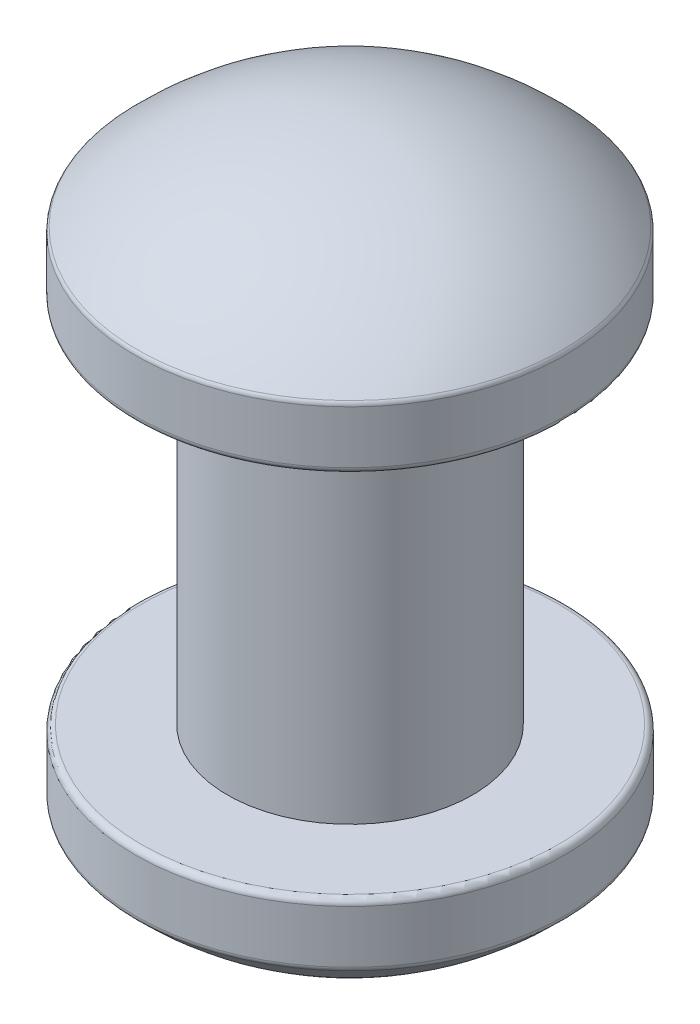
from build123d import *

# Parameters (mm, degrees)
DOME1_FACE_RADIUS = 0.35
DOME1_HEIGHT      = 0.15
DOME2_FACE_RADIUS = 0.35
DOME2_HEIGHT      = 0.15
FILLET1_R         = 0.01


with BuildPart() as part:
    # Sketch1 → Revolve1 (revolve)
    with BuildSketch(Plane.XY, mode=Mode.PRIVATE) as revolve1_sk:
        Polygon((0, -0.4), (0, 0.4), (0.35, 0.4), (0.35, 0.3), (0.2, 0.3), (0.2, -0.3), (0.35, -0.3), (0.35, -0.4), align=None)
    revolve(revolve1_sk.sketch.rotate(Axis((0, -0.4, 0), (0, 1, 0)), 90), axis=Axis((0, -0.4, 0), (0, 1, 0)))

    # Dome1: a dome of height H over a round flat face of radius A is a cap of a sphere of radius (A * A + H * H) / (2 * H)
    dome1_r = (DOME1_FACE_RADIUS * DOME1_FACE_RADIUS + DOME1_HEIGHT * DOME1_HEIGHT) / (2 * DOME1_HEIGHT)
    dome1_base = Plane((0, 0.4, 0), z_dir=(0, 1, 0))
    with Locations(dome1_base.offset(DOME1_HEIGHT - dome1_r)):
        dome1_ball = Sphere(dome1_r, mode=Mode.PRIVATE)
    add(split(dome1_ball, bisect_by=dome1_base, keep=Keep.TOP, mode=Mode.PRIVATE))

    # Dome2: a dome of height H over a round flat face of radius A is a cap of a sphere of radius (A * A + H * H) / (2 * H)
    dome2_r = (DOME2_FACE_RADIUS * DOME2_FACE_RADIUS + DOME2_HEIGHT * DOME2_HEIGHT) / (2 * DOME2_HEIGHT)
    dome2_base = Plane((0, -0.4, 0), z_dir=(0, -1, 0))
    with Locations(dome2_base.offset(DOME2_HEIGHT - dome2_r)):
        dome2_ball = Sphere(dome2_r, mode=Mode.PRIVATE)
    add(split(dome2_ball, bisect_by=dome2_base, keep=Keep.TOP, mode=Mode.PRIVATE))

    # Fillet1
    fillet1_edges = [part.edges().sort_by_distance(p)[0] for p in [
        (0.35, 0.4, 0),
        (0, -0.4, 0.35),
        (0, -0.3, 0.35),
        (0, 0.3, 0.35),
    ]]
    fillet(fillet1_edges, radius=FILLET1_R)


solid = part.part
